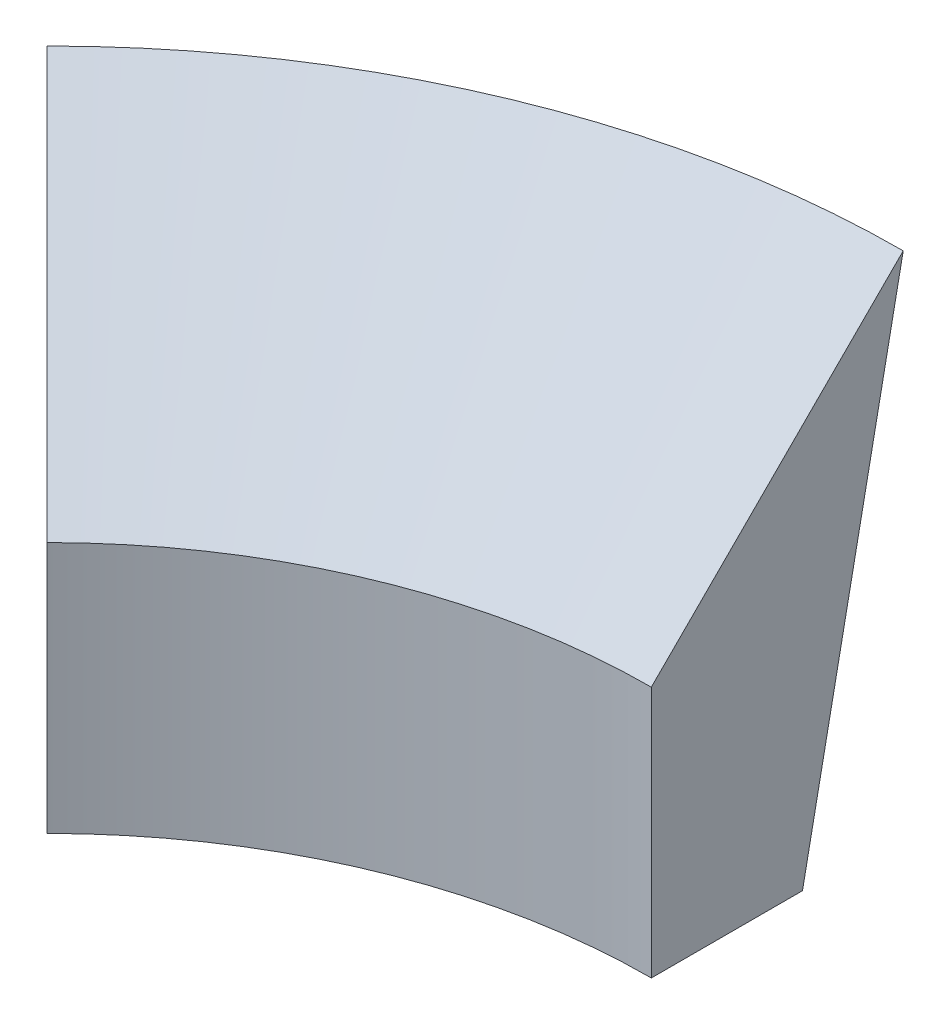
from build123d import *

# Parameters (mm, degrees)
CUT_EXTRUDE_1_DEPTH      = 246.560583156
CUT_EXTRUDE_1_DEPTH_BACK = 246.560583156


with BuildPart() as part:
    # 草圖1 → 旋轉2 (revolve)
    with BuildSketch(Plane.XY):
        Polygon((-120, -40), (-120, 0), (-170, 50), (-150, -50), (-120, -50), align=None)
    revolve(axis=Axis((0, 0, 0), (0, -1, 0)))

    # 草圖2 → 除料-伸長1 (cut, two sides: drawn at the far end of the back side and taken through both)
    with BuildSketch(Plane(origin=(0, 0, 0), x_dir=(1, 0, 0), z_dir=(0, 1, 0)).offset(-CUT_EXTRUDE_1_DEPTH_BACK)):
        with BuildLine():
            Line((0, 0), (-120.208152802, 120.208152802))
            ThreePointArc((-120.208152802, 120.208152802), (65.056183502, -157.059520527), (0, 170))
            Line((0, 170), (0, 0))
        make_face()
    extrude(amount=CUT_EXTRUDE_1_DEPTH + CUT_EXTRUDE_1_DEPTH_BACK, mode=Mode.SUBTRACT)


solid = part.part
